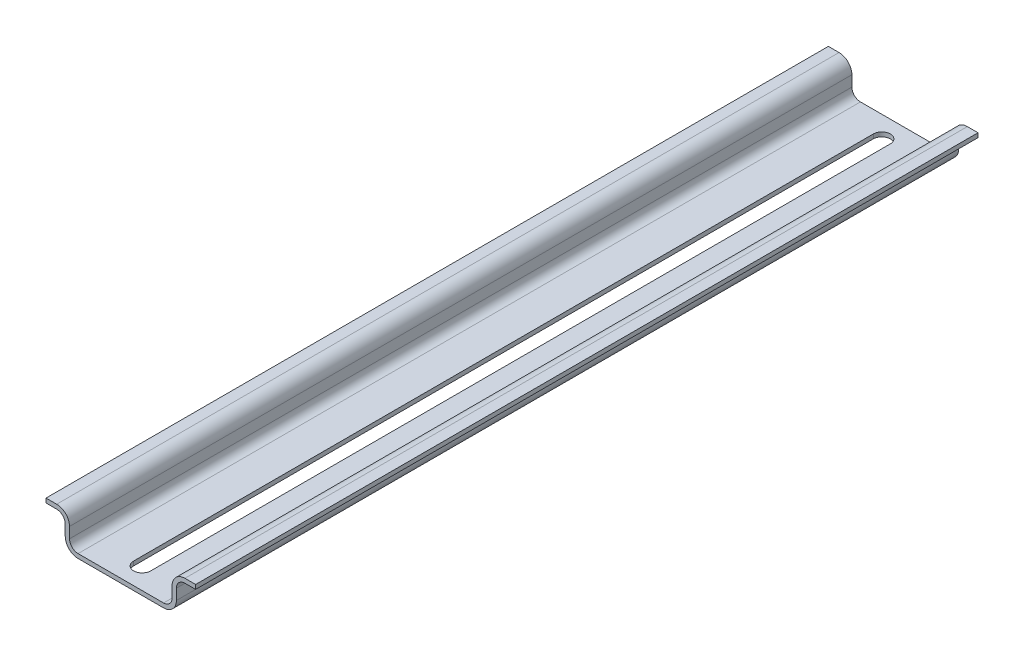
from build123d import *

# Parameters (mm, degrees)
BOSS_EXTRUDE1_DEPTH = 183
CUT_EXTRUDE1_REACH  = 188.468


with BuildPart() as part:
    # Sketch1 → Boss-Extrude1 (new body)
    with BuildSketch(Plane.XY):
        with BuildLine():
            Line((0, -2.722861027), (2.5, -2.722861027))
            ThreePointArc((2.5, -2.722861027), (3.914213562, -3.308647465), (4.5, -4.722861027))
            Line((4.5, -4.722861027), (4.5, -7.222861027))
            ThreePointArc((4.5, -7.222861027), (5.378679656, -9.344181371), (7.5, -10.222861027))
            Line((7.5, -10.222861027), (17.5, -10.222861027))
            Line((17.5, -10.222861027), (27.5, -10.222861027))
            ThreePointArc((27.5, -10.222861027), (29.621320344, -9.344181371), (30.5, -7.222861027))
            Line((30.5, -7.222861027), (30.5, -4.722861027))
            ThreePointArc((30.5, -4.722861027), (31.085786438, -3.308647465), (32.5, -2.722861027))
            Line((32.5, -2.722861027), (35, -2.722861027))
            Line((35, -2.722861027), (35, -1.722861027))
            Line((35, -1.722861027), (32.5, -1.722861027))
            ThreePointArc((32.5, -1.722861027), (30.378679656, -2.601540684), (29.5, -4.722861027))
            Line((29.5, -4.722861027), (29.5, -7.222861027))
            ThreePointArc((29.5, -7.222861027), (28.914213562, -8.63707459), (27.5, -9.222861027))
            Line((27.5, -9.222861027), (17.5, -9.222861027))
            Line((17.5, -9.222861027), (7.5, -9.222861027))
            ThreePointArc((7.5, -9.222861027), (6.085786438, -8.63707459), (5.5, -7.222861027))
            Line((5.5, -7.222861027), (5.5, -4.722861027))
            ThreePointArc((5.5, -4.722861027), (4.621320344, -2.601540684), (2.5, -1.722861027))
            Line((2.5, -1.722861027), (0, -1.722861027))
            Line((0, -1.722861027), (0, -2.722861027))
        make_face()
    extrude(amount=BOSS_EXTRUDE1_DEPTH)

    # Sketch2 → Cut-Extrude1 (cut, up to next)
    with BuildSketch(Plane(origin=(0, -9.222861027, 0), x_dir=(1, 0, 0), z_dir=(0, 1, 0)), mode=Mode.PRIVATE) as cut_extrude1_sk1:
        with BuildLine():
            Line((15.5, -178), (15.5, -5))
            ThreePointArc((15.5, -5), (17.5, -3), (19.5, -5))
            Line((19.5, -5), (19.5, -178))
            ThreePointArc((19.5, -178), (17.5, -180), (15.5, -178))
        make_face()
    cut_extrude1_tool1 = extrude(cut_extrude1_sk1.sketch, amount=-CUT_EXTRUDE1_REACH, mode=Mode.PRIVATE) & part.part
    add(cut_extrude1_tool1.solids().sort_by_distance((17.5, -9.222861, 91.5))[0], mode=Mode.SUBTRACT)


solid = part.part
